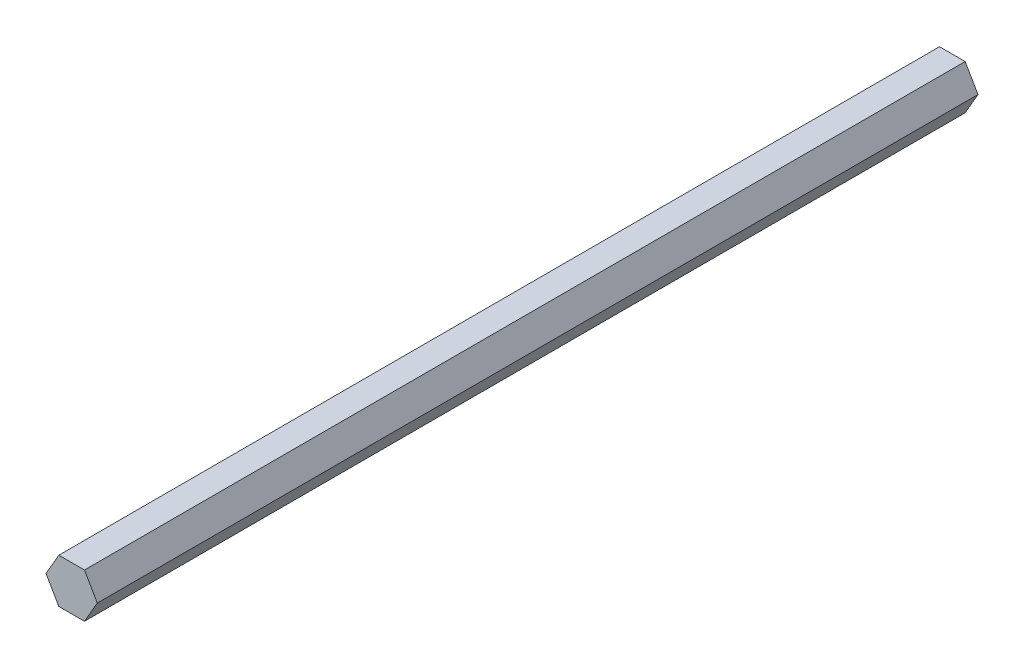
from build123d import *

# Parameters (mm, degrees)
AXIS_DEPTH = 34.3


with BuildPart() as part:
    # AxisSke → Axis (new body)
    with BuildSketch(Plane.XY):
        Polygon((0.998815966, 0), (0.499407983, 0.865), (-0.499407983, 0.865), (-0.998815966, 0), (-0.499407983, -0.865), (0.499407983, -0.865), align=None)
    extrude(amount=AXIS_DEPTH)


solid = part.part
